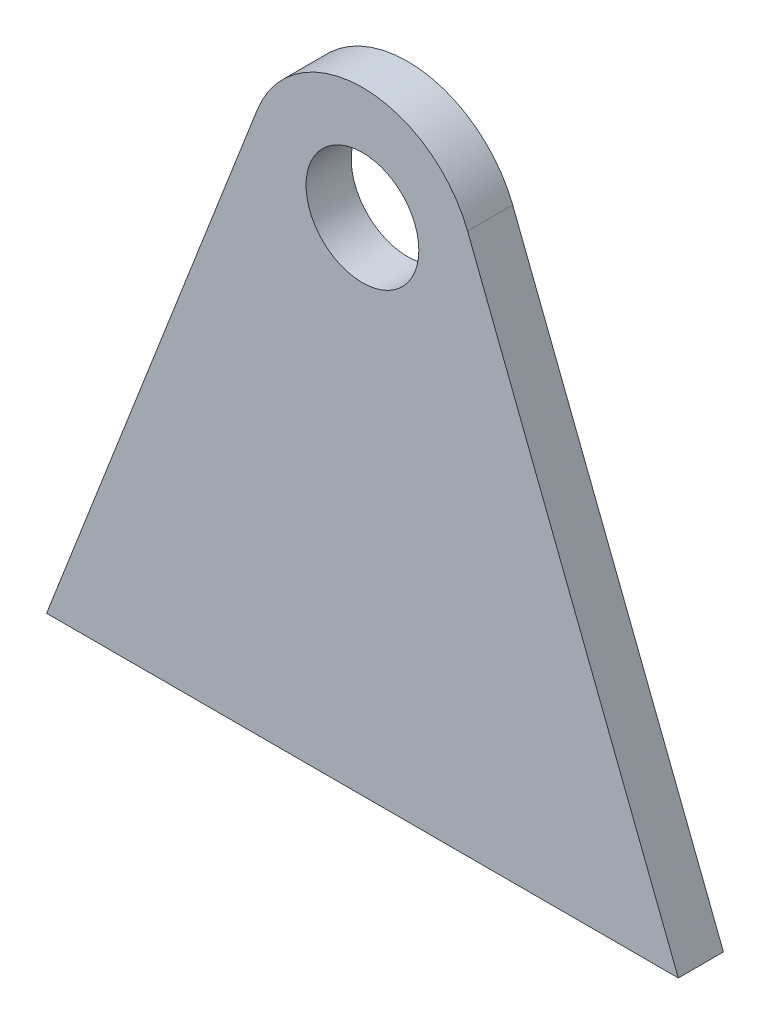
from build123d import *

# Parameters (mm, degrees)
SKETCH_1_R      = 25
EXTRUDE_1_DEPTH = 20


with BuildPart() as part:
    # 草圖1 → 填料-伸長1 (new body)
    with BuildSketch(Plane.XY):
        with BuildLine():
            Line((0, 0), (280, 0))
            Line((280, 0), (186.595569209, 240))
            ThreePointArc((186.595569209, 240), (140, 271.865697419), (93.404430791, 240))
            Line((93.404430791, 240), (0, 0))
        make_face()
        with Locations((140, 221.865697419)):
            Circle(SKETCH_1_R, mode=Mode.SUBTRACT)
    extrude(amount=EXTRUDE_1_DEPTH)


solid = part.part
